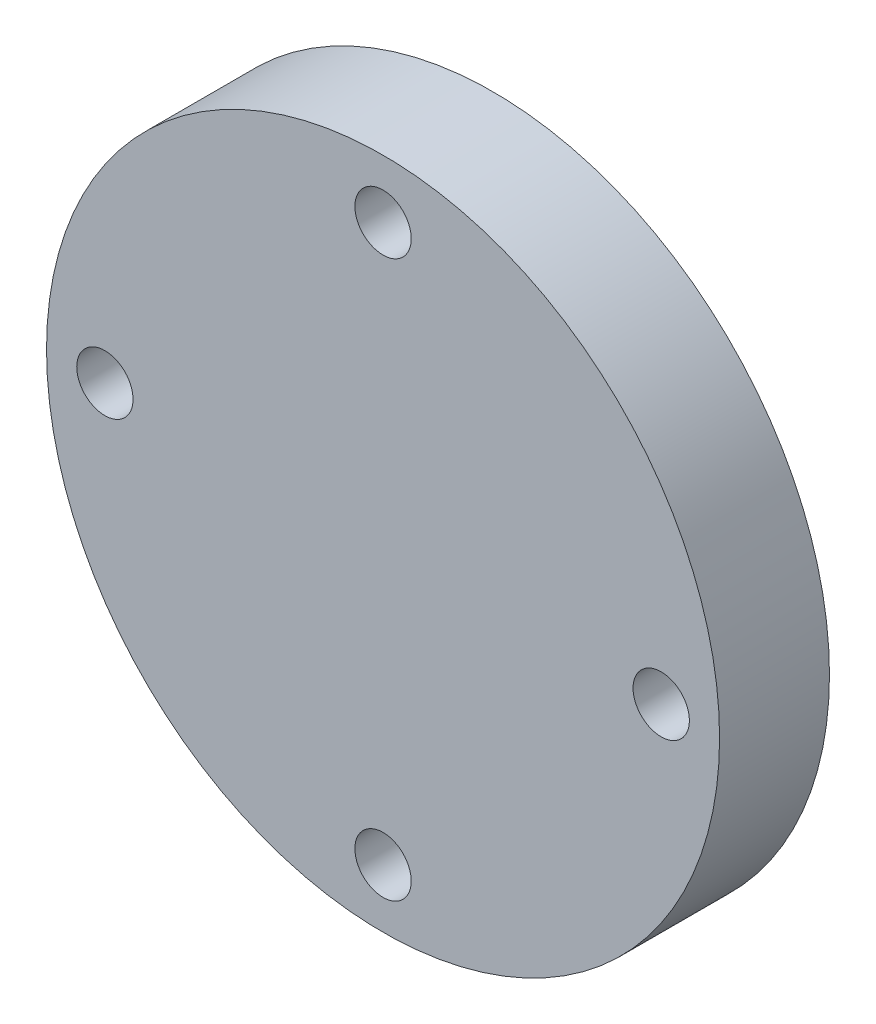
from build123d import *

# Parameters (mm, degrees)
SKETCH1_R           = 24.5
SKETCH1_R_2         = 16
BOSS_EXTRUDE1_DEPTH = 3
SKETCH2_R           = 24.5
BOSS_EXTRUDE2_DEPTH = 5
SKETCH3_R           = 2.05
CUT_EXTRUDE1_DEPTH  = 36.559808773
SKETCH4_R           = 1.5
CUT_EXTRUDE2_DEPTH  = 3


with BuildPart() as part:
    # Sketch1 → Boss-Extrude1 (new body)
    with BuildSketch(Plane.XY):
        Circle(SKETCH1_R)
        Circle(SKETCH1_R_2, mode=Mode.SUBTRACT)
    extrude(amount=BOSS_EXTRUDE1_DEPTH)

    # Sketch2 → Boss-Extrude2 (add)
    with BuildSketch(Plane.XY.offset(3)):
        Circle(SKETCH2_R)
    extrude(amount=BOSS_EXTRUDE2_DEPTH)

    # Sketch3 → Cut-Extrude1 (cut, through all)
    with BuildSketch(Plane(origin=(0, 0, 0), x_dir=(-1, 0, 0), z_dir=(0, 0, -1))):
        with Locations((0, 20.25)):
            Circle(SKETCH3_R)
        with Locations((20.25, 0)):
            Circle(SKETCH3_R)
        with Locations((0, -20.25)):
            Circle(SKETCH3_R)
        with Locations((-20.25, 0)):
            Circle(SKETCH3_R)
    extrude(amount=-CUT_EXTRUDE1_DEPTH, mode=Mode.SUBTRACT)

    # Sketch4 → Cut-Extrude2 (cut)
    with BuildSketch(Plane(origin=(0, 0, 3), x_dir=(-1, 0, 0), z_dir=(0, 0, -1))):
        Circle(SKETCH4_R)
    extrude(amount=-CUT_EXTRUDE2_DEPTH, mode=Mode.SUBTRACT)


solid = part.part
